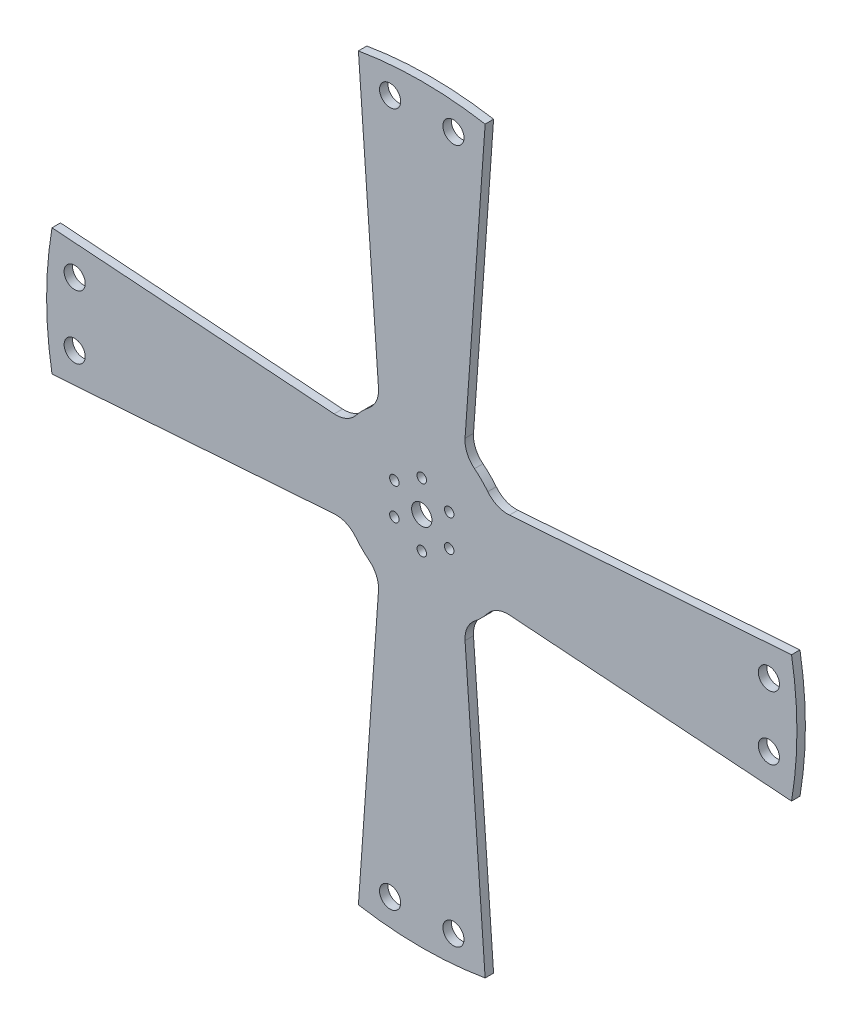
from build123d import *

# Parameters (mm, degrees)
SKETCH1_R           = 3.048
SKETCH1_R_2         = 3.175
BOSS_EXTRUDE1_DEPTH = 2.54
FILLET1_R           = 7.62
SKETCH2_R           = 1.4224
CUT_EXTRUDE1_DEPTH  = 160.50957323


with BuildPart() as part:
    # Sketch1 → Boss-Extrude1 (new body)
    with BuildSketch(Plane.XY):
        with BuildLine():
            Line((-19.05, 111.155403269), (-12.7, 21.997045256))
            ThreePointArc((-12.7, 21.997045256), (-17.960512242, 17.960512242), (-21.997045256, 12.7))
            Line((-21.997045256, 12.7), (-111.155403269, 19.05))
            ThreePointArc((-111.155403269, 19.05), (-112.776, 0), (-111.155403269, -19.05))
            Line((-111.155403269, -19.05), (-21.997045256, -12.7))
            ThreePointArc((-21.997045256, -12.7), (-17.960512242, -17.960512242), (-12.7, -21.997045256))
            Line((-12.7, -21.997045256), (-19.05, -111.155403269))
            ThreePointArc((-19.05, -111.155403269), (0, -112.776), (19.05, -111.155403269))
            Line((19.05, -111.155403269), (12.7, -21.997045256))
            ThreePointArc((12.7, -21.997045256), (17.960512242, -17.960512242), (21.997045256, -12.7))
            Line((21.997045256, -12.7), (111.155403269, -19.05))
            ThreePointArc((111.155403269, -19.05), (112.776, 0), (111.155403269, 19.05))
            Line((111.155403269, 19.05), (21.997045256, 12.7))
            ThreePointArc((21.997045256, 12.7), (17.960512242, 17.960512242), (12.7, 21.997045256))
            Line((12.7, 21.997045256), (19.05, 111.155403269))
            ThreePointArc((19.05, 111.155403269), (0, 112.776), (-19.05, 111.155403269))
        make_face()
        Circle(SKETCH1_R, mode=Mode.SUBTRACT)
        with Locations((9.525, 104.341147205)):
            Circle(SKETCH1_R_2, mode=Mode.SUBTRACT)
        with Locations((-9.525, 104.341147205)):
            Circle(SKETCH1_R_2, mode=Mode.SUBTRACT)
        with Locations((104.341147205, 9.525)):
            Circle(SKETCH1_R_2, mode=Mode.SUBTRACT)
        with Locations((104.341147205, -9.525)):
            Circle(SKETCH1_R_2, mode=Mode.SUBTRACT)
        with Locations((9.525, -104.341147205)):
            Circle(SKETCH1_R_2, mode=Mode.SUBTRACT)
        with Locations((-9.525, -104.341147205)):
            Circle(SKETCH1_R_2, mode=Mode.SUBTRACT)
        with Locations((-104.341147205, -9.525)):
            Circle(SKETCH1_R_2, mode=Mode.SUBTRACT)
        with Locations((-104.341147205, 9.525)):
            Circle(SKETCH1_R_2, mode=Mode.SUBTRACT)
    extrude(amount=BOSS_EXTRUDE1_DEPTH)

    # Fillet1
    fillet1_edges = [part.edges().sort_by_distance(p)[0] for p in [
        (12.7, 21.997045256, 1.27),
        (21.997045256, 12.7, 1.27),
        (21.997045256, -12.7, 1.27),
        (12.7, -21.997045256, 1.27),
        (-12.7, -21.997045256, 1.27),
        (-21.997045256, -12.7, 1.27),
        (-21.997045256, 12.7, 1.27),
        (-12.7, 21.997045256, 1.27),
    ]]
    fillet(fillet1_edges, radius=FILLET1_R)

    # Sketch2 → Cut-Extrude1 (cut, through all)
    with BuildSketch(Plane.XY):
        with Locations((0, 9.525)):
            Circle(SKETCH2_R)
        with Locations((8.248891971, 4.7625)):
            Circle(SKETCH2_R)
        with Locations((8.248891971, -4.7625)):
            Circle(SKETCH2_R)
        with Locations((0, -9.525)):
            Circle(SKETCH2_R)
        with Locations((-8.248891971, -4.7625)):
            Circle(SKETCH2_R)
        with Locations((-8.248891971, 4.7625)):
            Circle(SKETCH2_R)
    extrude(amount=CUT_EXTRUDE1_DEPTH, mode=Mode.SUBTRACT)


solid = part.part
